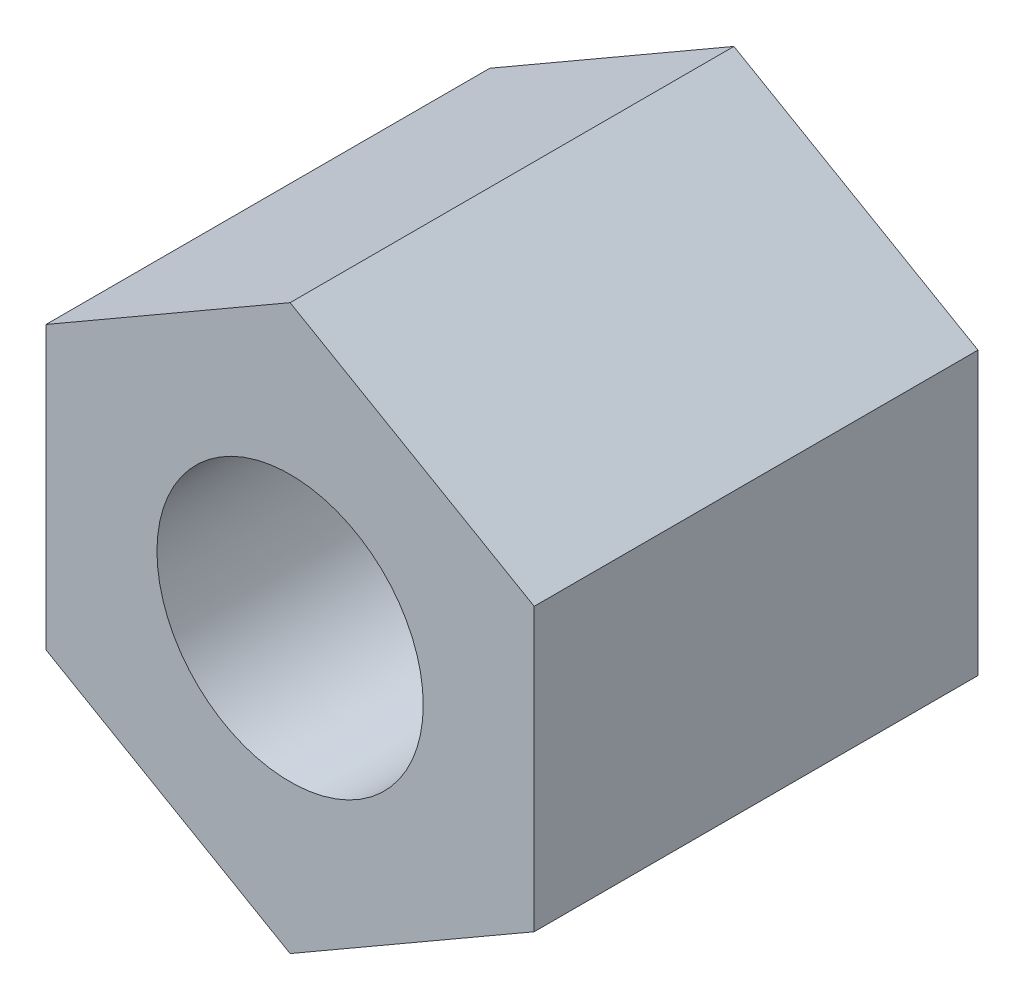
from build123d import *

# Parameters (mm, degrees)
AUFSATZ_LINEAR_AUSTRAGEN1_DEPTH = 5
SKIZZE2_R                       = 1.5
SCHNITT_LINEAR_AUSTRAGEN1_DEPTH = 5


with BuildPart() as part:
    # Skizze1 → Aufsatz-Linear austragen1 (new body)
    with BuildSketch(Plane(origin=(0, 0, 0), x_dir=(0, 1, 0), z_dir=(0, 0, 1))):
        Polygon((3.175426481, 0), (1.58771324, 2.75), (-1.58771324, 2.75), (-3.175426481, 0), (-1.58771324, -2.75), (1.58771324, -2.75), align=None)
    extrude(amount=AUFSATZ_LINEAR_AUSTRAGEN1_DEPTH)

    # Skizze2 → Schnitt-Linear austragen1 (cut)
    with BuildSketch(Plane.XY.offset(5)):
        Circle(SKIZZE2_R)
    extrude(amount=-SCHNITT_LINEAR_AUSTRAGEN1_DEPTH, mode=Mode.SUBTRACT)


solid = part.part
